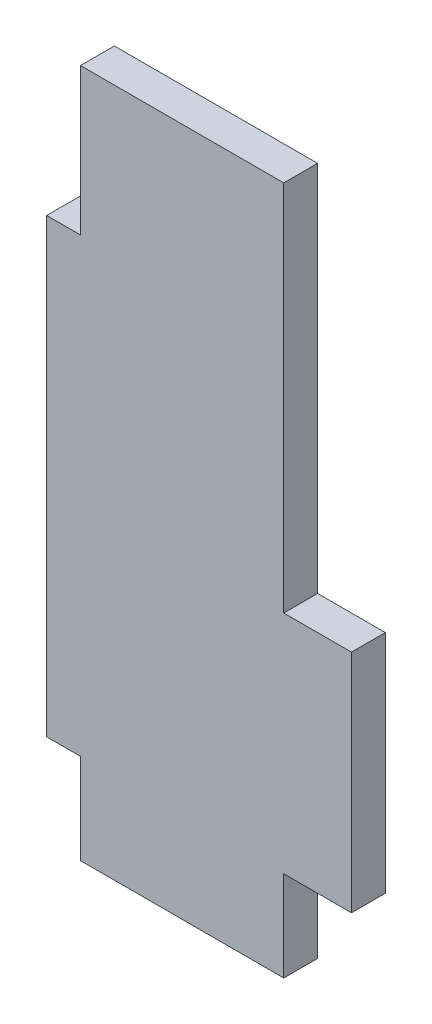
from build123d import *

# Parameters (mm, degrees)
SKETCH1_W           = 18
SKETCH1_H           = 61
BASE_SHAPE_DEPTH    = 3
SKETCH2_W           = 6
SKETCH2_H           = 20
SKETCH2_W_2         = 3
SKETCH2_H_2         = 40
BOSS_EXTRUDE2_DEPTH = 3


with BuildPart() as part:
    # Sketch1 → Base Shape (new body)
    with BuildSketch(Plane.XY):
        with Locations((-9, 30.5)):
            Rectangle(SKETCH1_W, SKETCH1_H)
    extrude(amount=BASE_SHAPE_DEPTH)

    # Sketch2 → Boss-Extrude2 (add)
    with BuildSketch(Plane.XY.offset(3)):
        with Locations((3, 18)):
            Rectangle(SKETCH2_W, SKETCH2_H)
        with Locations((-19.5, 28)):
            Rectangle(SKETCH2_W_2, SKETCH2_H_2)
    extrude(amount=-BOSS_EXTRUDE2_DEPTH)


solid = part.part
